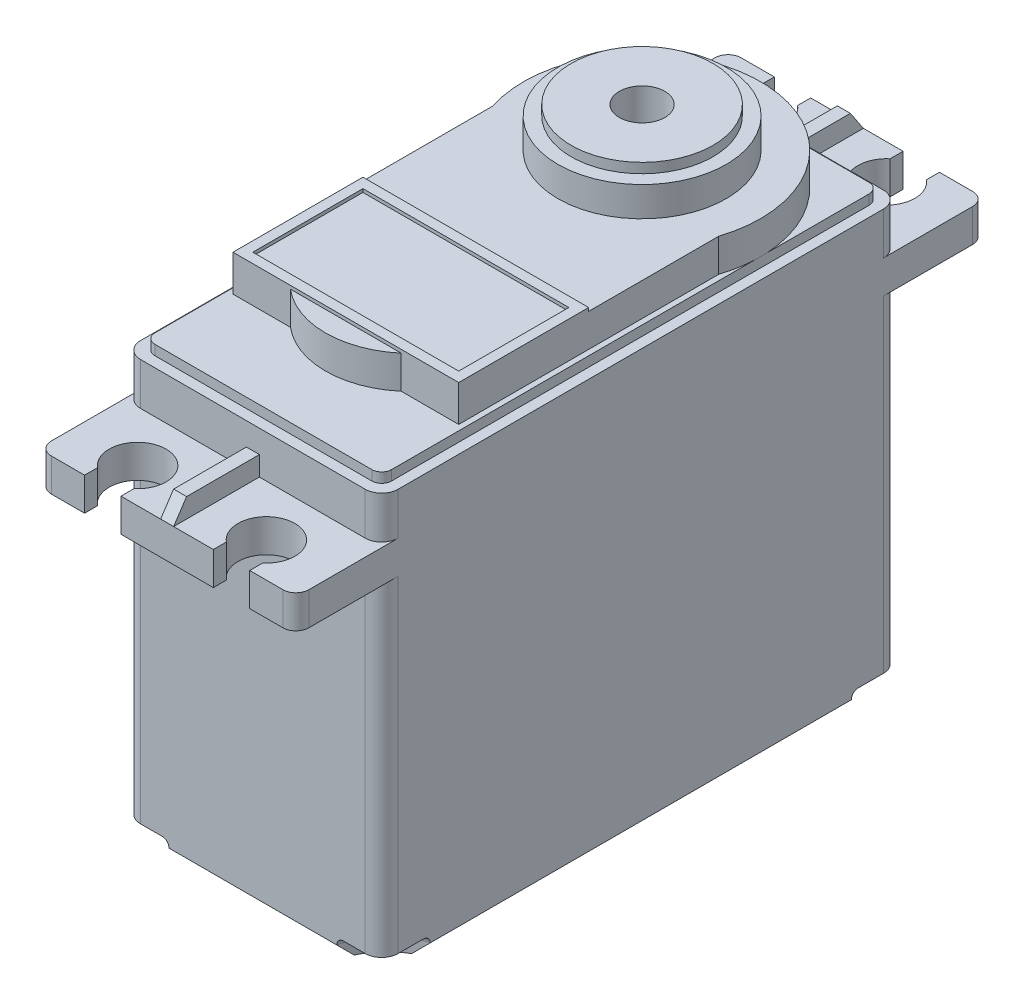
from build123d import *

# Parameters (mm, degrees)
SKETCH1_W            = 19.82
SKETCH1_H            = 39.88
BOSS_EXTRUDE1_DEPTH  = 36.02
SKETCH2_W            = 19.82
SKETCH2_H            = 6.6
BOSS_EXTRUDE2_DEPTH  = 2.54
CUT_EXTRUDE1_DEPTH   = 2.54
SKETCH4_W            = 1
SKETCH4_H            = 6.6
BOSS_EXTRUDE3_DEPTH  = 1.5
CUT_EXTRUDE2_DEPTH   = 1
SKETCH6_W            = 19.82
SKETCH6_H            = 39.88
CUT_EXTRUDE3_DEPTH   = 3.55
SKETCH7_W            = 18.22
SKETCH7_H            = 38.272033082
BOSS_EXTRUDE4_DEPTH  = 0.762
FILLET1_R            = 1.27
FILLET2_R            = 0.762
BOSS_EXTRUDE5_DEPTH  = 2.54
SKETCH10_R           = 6.477
BOSS_EXTRUDE6_DEPTH  = 2.286
SKETCH11_R           = 5.461
BOSS_EXTRUDE7_DEPTH  = 0.762
SKETCH12_R           = 1.75
CUT_EXTRUDE4_DEPTH   = 2.54
SKETCH13_W           = 17.371497452
SKETCH13_H           = 10
SKETCH13_W_2         = 15.847497452
SKETCH13_H_2         = 8.476
BOSS_EXTRUDE8_DEPTH  = 0.254
BOSS_EXTRUDE9_DEPTH  = 2.54
CUT_EXTRUDE5_DEPTH   = 1.524
SKETCH16_R           = 0.5
CUT_EXTRUDE6_DEPTH   = 6
CHAMFER1_SIZE        = 1
FILLET3_R            = 0.5
SKETCH17_W           = 6.35
SKETCH17_H           = 3.81
BOSS_EXTRUDE10_DEPTH = 1.5
FILLET5_R            = 0.5
FILLET6_R            = 1


with BuildPart() as part:
    # Sketch1 → Boss-Extrude1 (new body)
    with BuildSketch(Plane(origin=(0, 0, 0), x_dir=(1, 0, 0), z_dir=(0, 1, 0))):
        Rectangle(SKETCH1_W, SKETCH1_H)
    extrude(amount=BOSS_EXTRUDE1_DEPTH)

    # Sketch2 → Boss-Extrude2 (add)
    with BuildSketch(Plane(origin=(0, 26.67, 0), x_dir=(1, 0, 0), z_dir=(0, 1, 0))):
        with Locations((0, 23.24)):
            Rectangle(SKETCH2_W, SKETCH2_H)
        with Locations((0, -23.24)):
            Rectangle(SKETCH2_W, SKETCH2_H)
    extrude(amount=BOSS_EXTRUDE2_DEPTH)

    # Sketch3 → Cut-Extrude1 (cut)
    with BuildSketch(Plane(origin=(0, 29.21, 0), x_dir=(1, 0, 0), z_dir=(0, 1, 0))):
        with BuildLine():
            Line((6.355, 26.54), (3.555, 26.54))
            Line((3.555, 26.54), (3.555, 25.539072445))
            ThreePointArc((3.555, 25.539072445), (4.955, 21.665), (6.355, 25.539072445))
            Line((6.355, 25.539072445), (6.355, 26.54))
        make_face()
        with BuildLine():
            Line((-6.355, 26.54), (-6.355, 25.539072445))
            ThreePointArc((-6.355, 25.539072445), (-4.955, 21.665), (-3.555, 25.539072445))
            Line((-3.555, 25.539072445), (-3.555, 26.54))
            Line((-3.555, 26.54), (-6.355, 26.54))
        make_face()
    cut_extrude1 = extrude(amount=-CUT_EXTRUDE1_DEPTH, mode=Mode.SUBTRACT)

    # Mirror1: Cut-Extrude1 across plane
    add(cut_extrude1.mirror(Plane.XY), mode=Mode.SUBTRACT)

    # Sketch4 → Boss-Extrude3 (add)
    with BuildSketch(Plane(origin=(0, 29.21, 0), x_dir=(1, 0, 0), z_dir=(0, 1, 0))):
        with Locations((0, 23.24)):
            Rectangle(SKETCH4_W, SKETCH4_H)
        with Locations((0, -23.24)):
            Rectangle(SKETCH4_W, SKETCH4_H)
    extrude(amount=BOSS_EXTRUDE3_DEPTH)

    # Sketch5 → Cut-Extrude2 (cut)
    with BuildSketch(Plane.ZY.offset(0.5)):
        Polygon((-26.54, 29.21), (-25.54, 30.71), (-26.54, 30.71), align=None)
        Polygon((26.54, 30.71), (26.54, 29.21), (25.54, 30.71), align=None)
    extrude(amount=-CUT_EXTRUDE2_DEPTH, mode=Mode.SUBTRACT)

    # Sketch6 → Cut-Extrude3 (cut)
    with BuildSketch(Plane(origin=(0, 36.02, 0), x_dir=(1, 0, 0), z_dir=(0, 1, 0))):
        Rectangle(SKETCH6_W, SKETCH6_H)
    extrude(amount=-CUT_EXTRUDE3_DEPTH, mode=Mode.SUBTRACT)

    # Sketch7 → Boss-Extrude4 (add)
    with BuildSketch(Plane(origin=(0, 32.47, 0), x_dir=(1, 0, 0), z_dir=(0, 1, 0))):
        Rectangle(SKETCH7_W, SKETCH7_H)
    extrude(amount=BOSS_EXTRUDE4_DEPTH)

    # Fillet1
    fillet1_edges = [part.edges().sort_by_distance(p)[0] for p in [
        (-9.91, 13.335, -19.94),
        (-9.91, 30.84, -19.94),
        (9.91, 13.335, -19.94),
        (9.91, 30.84, -19.94),
        (9.91, 13.335, 19.94),
        (9.91, 30.84, 19.94),
        (-9.91, 13.335, 19.94),
        (-9.91, 30.84, 19.94),
    ]]
    fillet(fillet1_edges, radius=FILLET1_R)

    # Fillet2
    fillet2_edges = [part.edges().sort_by_distance(p)[0] for p in [
        (9.11, 32.851, -19.136016541),
        (-9.11, 32.851, -19.136016541),
        (-9.11, 32.851, 19.136016541),
        (9.11, 32.851, 19.136016541),
    ]]
    fillet(fillet2_edges, radius=FILLET2_R)

    # Sketch8 → Boss-Extrude5 (add)
    with BuildSketch(Plane(origin=(0, 33.232, 0), x_dir=(1, 0, 0), z_dir=(0, 1, 0))):
        with BuildLine():
            Line((8.685748726, 7.213983459), (8.685748726, -12.786016541))
            Line((8.685748726, -12.786016541), (-8.685748726, -12.786016541))
            Line((-8.685748726, -12.786016541), (-8.685748726, 7.213983459))
            ThreePointArc((-8.685748726, 7.213983459), (0, 19.136016541), (8.685748726, 7.213983459))
        make_face()
    extrude(amount=BOSS_EXTRUDE5_DEPTH)

    # Sketch10 → Boss-Extrude6 (add)
    with BuildSketch(Plane(origin=(0, 35.772, 0), x_dir=(1, 0, 0), z_dir=(0, 1, 0))):
        with Locations(Location((0, 10.011016541, 0), (0, 0, 270))):
            Circle(SKETCH10_R)
    extrude(amount=BOSS_EXTRUDE6_DEPTH)

    # Sketch11 → Boss-Extrude7 (add)
    with BuildSketch(Plane(origin=(0, 38.058, 0), x_dir=(1, 0, 0), z_dir=(0, 1, 0))):
        with Locations(Location((0, 10.011016541, 0), (0, 0, 90))):
            Circle(SKETCH11_R)
    extrude(amount=BOSS_EXTRUDE7_DEPTH)

    # Sketch12 → Cut-Extrude4 (cut)
    with BuildSketch(Plane(origin=(0, 38.82, 0), x_dir=(1, 0, 0), z_dir=(0, 1, 0))):
        with Locations(Location((0, 10.011016541, 0), (0, 0, 270))):
            Circle(SKETCH12_R)
    extrude(amount=-CUT_EXTRUDE4_DEPTH, mode=Mode.SUBTRACT)

    # Sketch13 → Boss-Extrude8 (add)
    with BuildSketch(Plane(origin=(0, 35.772, 0), x_dir=(1, 0, 0), z_dir=(0, 1, 0))):
        with Locations((0, -7.786016541)):
            Rectangle(SKETCH13_W, SKETCH13_H)
        with Locations((0, -7.786016541)):
            Rectangle(SKETCH13_W_2, SKETCH13_H_2, mode=Mode.SUBTRACT)
    extrude(amount=BOSS_EXTRUDE8_DEPTH)

    # Sketch14 → Boss-Extrude9 (add)
    with BuildSketch(Plane(origin=(0, 33.232, 0), x_dir=(1, 0, 0), z_dir=(0, 1, 0))):
        with BuildLine():
            Line((-4.260362688, -12.786016541), (4.260362688, -12.786016541))
            ThreePointArc((4.260362688, -12.786016541), (0, -14.354935039), (-4.260362688, -12.786016541))
        make_face()
    extrude(amount=BOSS_EXTRUDE9_DEPTH)

    # Sketch15 → Cut-Extrude5 (cut)
    with BuildSketch(Plane(origin=(0, 0, 0), x_dir=(-1, 0, 0), z_dir=(0, -1, 0))):
        with BuildLine():
            Line((6.46365167, -19.94), (9.91, -19.94))
            Line((9.91, -19.94), (9.91, -16.211847956))
            ThreePointArc((9.91, -16.211847956), (7.678426739, -17.605953774), (6.46365167, -19.94))
        make_face()
        with BuildLine():
            Line((-9.91, -19.94), (-9.91, -16.211847956))
            ThreePointArc((-9.91, -16.211847956), (-7.678426739, -17.605953774), (-6.46365167, -19.94))
            Line((-6.46365167, -19.94), (-9.91, -19.94))
        make_face()
        with BuildLine():
            Line((-6.46365167, 19.94), (-9.91, 19.94))
            Line((-9.91, 19.94), (-9.91, 16.211847956))
            ThreePointArc((-9.91, 16.211847956), (-7.678426739, 17.605953774), (-6.46365167, 19.94))
        make_face()
        with BuildLine():
            Line((9.91, 19.94), (9.91, 16.211847956))
            ThreePointArc((9.91, 16.211847956), (7.678426739, 17.605953774), (6.46365167, 19.94))
            Line((6.46365167, 19.94), (9.91, 19.94))
        make_face()
    extrude(amount=-CUT_EXTRUDE5_DEPTH, mode=Mode.SUBTRACT)

    # Sketch16 → Cut-Extrude6 (cut)
    with BuildSketch(Plane(origin=(0, 0, 0), x_dir=(-1, 0, 0), z_dir=(0, -1, 0))):
        with Locations(Location((8.64, -18.67, 0), (0, 0, 90))):
            Circle(SKETCH16_R)
        with Locations(Location((-8.64, -18.67, 0), (0, 0, 270))):
            Circle(SKETCH16_R)
        with Locations(Location((-8.64, 18.67, 0), (0, 0, 90))):
            Circle(SKETCH16_R)
        with Locations(Location((8.64, 18.67, 0), (0, 0, 270))):
            Circle(SKETCH16_R)
    extrude(amount=-CUT_EXTRUDE6_DEPTH, mode=Mode.SUBTRACT)

    # Chamfer1
    chamfer1_edges = [part.edges().sort_by_distance(p)[0] for p in [
        (0, 0, 19.94),
        (9.91, 0, 0),
        (0, 0, -19.94),
        (-9.91, 0, 0),
    ]]
    chamfer(chamfer1_edges, length=CHAMFER1_SIZE)

    # Fillet3
    fillet3_edges = [part.edges().sort_by_distance(p)[0] for p in [
        (-7.678426739, 1.524, 17.605953774),
        (7.678426739, 1.524, 17.605953774),
        (7.678426739, 1.524, -17.605953774),
        (-7.678426739, 1.524, -17.605953774),
    ]]
    fillet(fillet3_edges, radius=FILLET3_R)

    # Sketch17 → Boss-Extrude10 (add)
    with BuildSketch(Plane(origin=(0, 0, -19.94), x_dir=(-1, 0, 0), z_dir=(0, 0, -1))):
        with Locations((0, 2.905)):
            Rectangle(SKETCH17_W, SKETCH17_H)
        Polygon((0, 1.5), (-2.675, 1.5), (-2.675, 4.31), (0, 4.31), (2.675, 4.31), (2.675, 1.5), align=None, mode=Mode.SUBTRACT)
    extrude(amount=BOSS_EXTRUDE10_DEPTH)

    # Fillet5
    fillet5_edges = [part.edges().sort_by_distance(p)[0] for p in [
        (3.175, 1, -20.69),
        (-3.175, 1, -20.69),
        (-3.175, 4.81, -20.69),
        (3.175, 4.81, -20.69),
    ]]
    fillet(fillet5_edges, radius=FILLET5_R)

    # Fillet6
    fillet6_edges = [part.edges().sort_by_distance(p)[0] for p in [
        (9.91, 27.94, 26.54),
        (9.91, 27.94, -26.54),
        (-9.91, 27.94, 26.54),
        (-9.91, 27.94, -26.54),
    ]]
    fillet(fillet6_edges, radius=FILLET6_R)


solid = part.part
